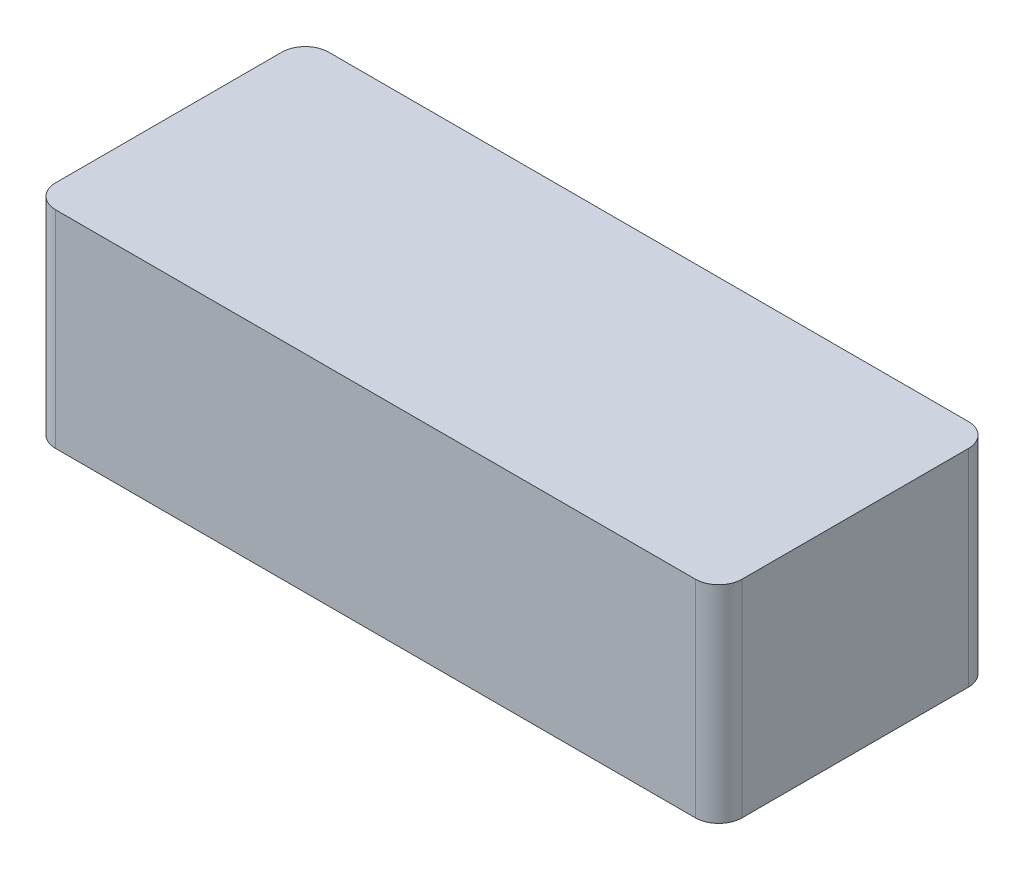
from build123d import *

# Parameters (mm, degrees)
CELL_PACK_DEPTH = 26.5
CONNECTOR_START = 8
CONNECTOR_DEPTH = 10


with BuildPart() as part:
    # SK_1 → Cell_Pack (new body)
    with BuildSketch(Plane(origin=(0, 0, 0), x_dir=(1, 0, 0), z_dir=(0, 1, 0))):
        with BuildLine():
            Line((-41, -17.5), (41, -17.5))
            ThreePointArc((41, -17.5), (43.121320344, -16.621320344), (44, -14.5))
            Line((44, -14.5), (44, 14.5))
            ThreePointArc((44, 14.5), (43.121320344, 16.621320344), (41, 17.5))
            Line((41, 17.5), (-41, 17.5))
            ThreePointArc((-41, 17.5), (-43.121320344, 16.621320344), (-44, 14.5))
            Line((-44, 14.5), (-44, -14.5))
            ThreePointArc((-44, -14.5), (-43.121320344, -16.621320344), (-41, -17.5))
        make_face()
    extrude(amount=CELL_PACK_DEPTH)

    # SK_2 → Connector (add)
    with BuildSketch(Plane(origin=(0, 0, 0), x_dir=(1, 0, 0), z_dir=(0, 1, 0)).offset(CONNECTOR_START)):
        with BuildLine():
            Line((-51, -6), (-45, -6))
            ThreePointArc((-45, -6), (-44.292893219, -5.707106781), (-44, -5))
            Line((-44, -5), (-44, 5))
            ThreePointArc((-44, 5), (-44.292893219, 5.707106781), (-45, 6))
            Line((-45, 6), (-51, 6))
            ThreePointArc((-51, 6), (-51.707106781, 5.707106781), (-52, 5))
            Line((-52, 5), (-52, -5))
            ThreePointArc((-52, -5), (-51.707106781, -5.707106781), (-51, -6))
        make_face()
    extrude(amount=CONNECTOR_DEPTH)


solid = part.part
